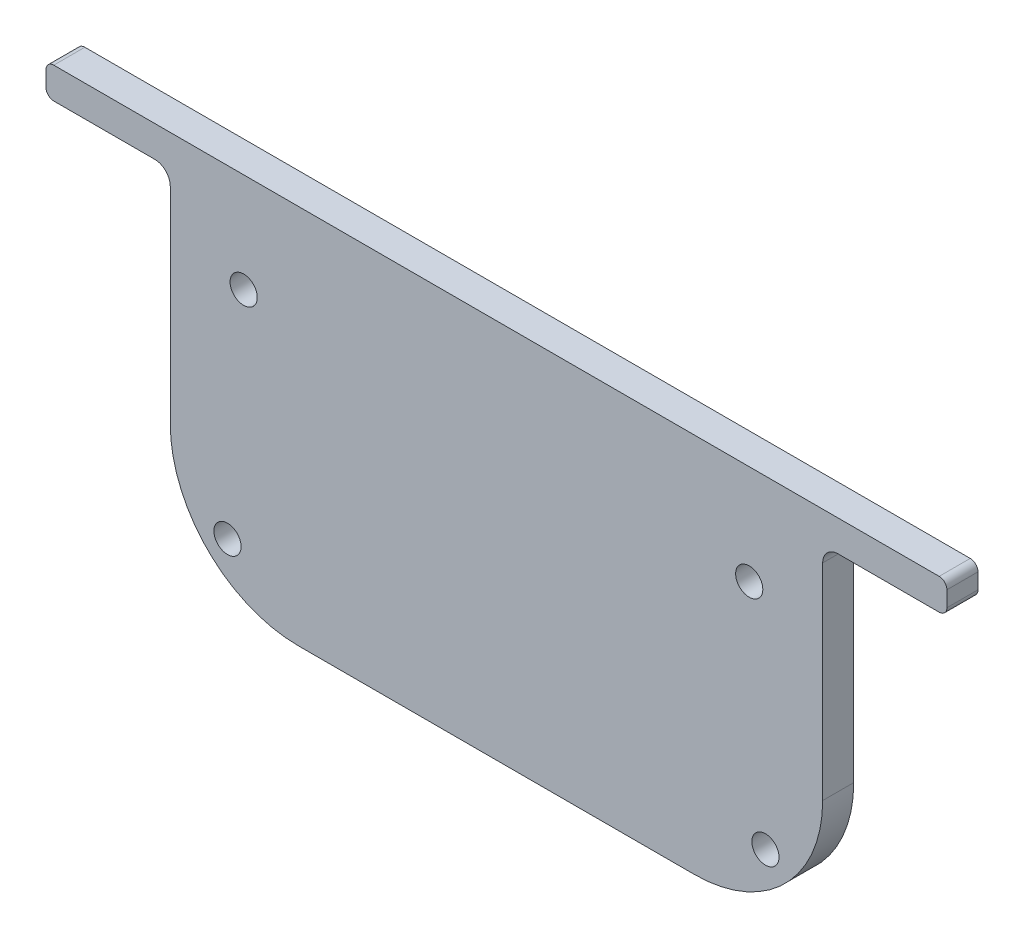
from build123d import *

# Parameters (mm, degrees)
SKETCH1_R           = 1.75
BOSS_EXTRUDE1_DEPTH = 4


with BuildPart() as part:
    # Sketch1 → Boss-Extrude1 (new body)
    with BuildSketch(Plane.XY):
        with BuildLine():
            Line((163.58008547, 21.295659048), (163.58008547, 47.795659048))
            ThreePointArc((163.58008547, 47.795659048), (164.165871907, 49.209872611), (165.58008547, 49.795659048))
            Line((165.58008547, 49.795659048), (178.58008547, 49.795659048))
            ThreePointArc((178.58008547, 49.795659048), (179.287192251, 50.088552267), (179.58008547, 50.795659048))
            Line((179.58008547, 50.795659048), (179.58008547, 52.795659048))
            ThreePointArc((179.58008547, 52.795659048), (179.287192251, 53.502765829), (178.58008547, 53.795659048))
            Line((178.58008547, 53.795659048), (64.58008547, 53.795659048))
            ThreePointArc((64.58008547, 53.795659048), (63.872978688, 53.502765829), (63.58008547, 52.795659048))
            Line((63.58008547, 52.795659048), (63.58008547, 50.795659048))
            ThreePointArc((63.58008547, 50.795659048), (63.872978688, 50.088552267), (64.58008547, 49.795659048))
            Line((64.58008547, 49.795659048), (77.58008547, 49.795659048))
            ThreePointArc((77.58008547, 49.795659048), (78.994299032, 49.209872611), (79.58008547, 47.795659048))
            Line((79.58008547, 47.795659048), (79.58008547, 21.295659048))
            ThreePointArc((79.58008547, 21.295659048), (84.41282358, 9.628397159), (96.08008547, 4.795659048))
            Line((96.08008547, 4.795659048), (147.08008547, 4.795659048))
            ThreePointArc((147.08008547, 4.795659048), (158.747347359, 9.628397159), (163.58008547, 21.295659048))
        make_face()
        with Locations((89.03008547, 40.987963894)):
            Circle(SKETCH1_R, mode=Mode.SUBTRACT)
        with Locations((86.946454525, 12.162028103)):
            Circle(SKETCH1_R, mode=Mode.SUBTRACT)
        with Locations((154.12258547, 40.987963894)):
            Circle(SKETCH1_R, mode=Mode.SUBTRACT)
        with Locations((156.213716414, 12.162028103)):
            Circle(SKETCH1_R, mode=Mode.SUBTRACT)
    extrude(amount=BOSS_EXTRUDE1_DEPTH)


solid = part.part
